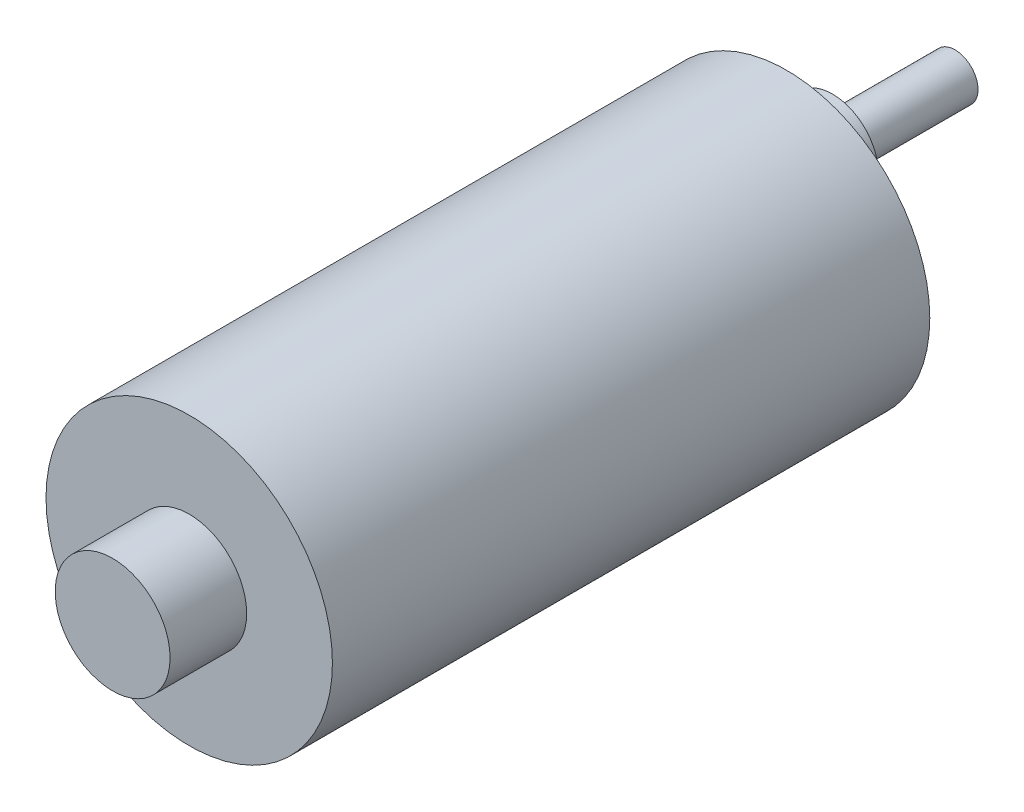
from build123d import *

# Parameters (mm, degrees)
SKETCH_1_R               = 18.7
EXTRUDE_1_DEPTH          = 78
SKETCH_2_R               = 7.5
EXTRUDE_2_DEPTH          = 10
CUT_EXTRUDE_1_DEPTH      = 92.887866446
CUT_EXTRUDE_1_DEPTH_BACK = 10
SKETCH_3_R               = 1.55
SKETCH_4_R               = 6
EXTRUDE_3_DEPTH          = 6
SKETCH_5_R               = 3
EXTRUDE_4_DEPTH          = 16


with BuildPart() as part:
    # 草图1 → 凸台-拉伸1 (new body)
    with BuildSketch(Plane.XY):
        Circle(SKETCH_1_R)
    extrude(amount=EXTRUDE_1_DEPTH)

    # 草图2 → 凸台-拉伸2 (add)
    with BuildSketch(Plane.XY.offset(78)):
        Circle(SKETCH_2_R)
    extrude(amount=EXTRUDE_2_DEPTH)

    # 草图3 → 切除-拉伸1 (cut, two sides: drawn at the far end of the back side and taken through both)
    with BuildSketch(Plane(origin=(0, 0, 0), x_dir=(-1, 0, 0), z_dir=(0, 0, -1)).offset(-CUT_EXTRUDE_1_DEPTH_BACK)):
        with Locations(Location((0, 15.5, 0), (0, 0, 180))):
            Circle(SKETCH_3_R)
        with Locations(Location((13.423393759, 7.75, 0), (0, 0, 180))):
            Circle(SKETCH_3_R)
        with Locations(Location((13.423393759, -7.75, 0), (0, 0, 180))):
            Circle(SKETCH_3_R)
        with Locations(Location((0, -15.5, 0), (0, 0, 180))):
            Circle(SKETCH_3_R)
        with Locations(Location((-13.423393759, -7.75, 0), (0, 0, 180))):
            Circle(SKETCH_3_R)
        with Locations(Location((-13.423393759, 7.75, 0), (0, 0, 180))):
            Circle(SKETCH_3_R)
    extrude(amount=CUT_EXTRUDE_1_DEPTH + CUT_EXTRUDE_1_DEPTH_BACK, mode=Mode.SUBTRACT)

    # 草图4 → 凸台-拉伸3 (add)
    with BuildSketch(Plane(origin=(0, 0, 0), x_dir=(-1, 0, 0), z_dir=(0, 0, -1))):
        with Locations(Location((0, 7, 0), (0, 0, 180))):
            Circle(SKETCH_4_R)
    extrude(amount=EXTRUDE_3_DEPTH)

    # 草图5 → 凸台-拉伸4 (add)
    with BuildSketch(Plane(origin=(0, 0, -6), x_dir=(-1, 0, 0), z_dir=(0, 0, -1))):
        with Locations((0, 7)):
            Circle(SKETCH_5_R)
    extrude(amount=EXTRUDE_4_DEPTH)


solid = part.part
